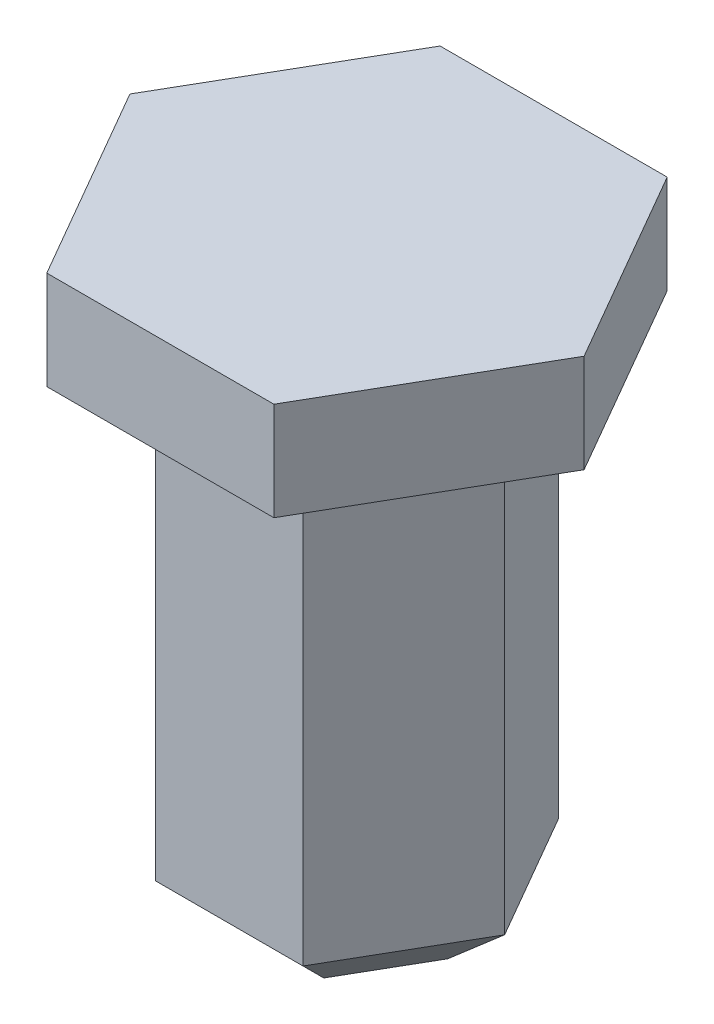
from build123d import *

# Parameters (mm, degrees)
BOSS_EXTRUDE1_DEPTH = 5
BOSS_EXTRUDE2_DEPTH = 1
CHAMFER1_SIZE       = 0.5


with BuildPart() as part:
    # Sketch1 → Boss-Extrude1 (new body)
    with BuildSketch(Plane(origin=(0, 0, 0), x_dir=(1, 0, 0), z_dir=(0, 1, 0))):
        Polygon((1.5011107, 0), (0.75055535, 1.3), (-0.75055535, 1.3), (-1.5011107, 0), (-0.75055535, -1.3), (0.75055535, -1.3), align=None)
    extrude(amount=BOSS_EXTRUDE1_DEPTH)

    # Sketch2 → Boss-Extrude2 (add)
    with BuildSketch(Plane(origin=(0, 5, 0), x_dir=(1, 0, 0), z_dir=(0, 1, 0))):
        Polygon((2.309401077, 0), (1.154700538, 2), (-1.154700538, 2), (-2.309401077, 0), (-1.154700538, -2), (1.154700538, -2), align=None)
    extrude(amount=BOSS_EXTRUDE2_DEPTH)

    # Chamfer1
    chamfer1_edges = [part.edges().sort_by_distance(p)[0] for p in [
        (0, 0, 1.3),
        (-1.125833025, 0, 0.65),
        (-1.125833025, 0, -0.65),
        (0, 0, -1.3),
        (1.125833025, 0, -0.65),
        (1.125833025, 0, 0.65),
    ]]
    chamfer(chamfer1_edges, length=CHAMFER1_SIZE)


solid = part.part
